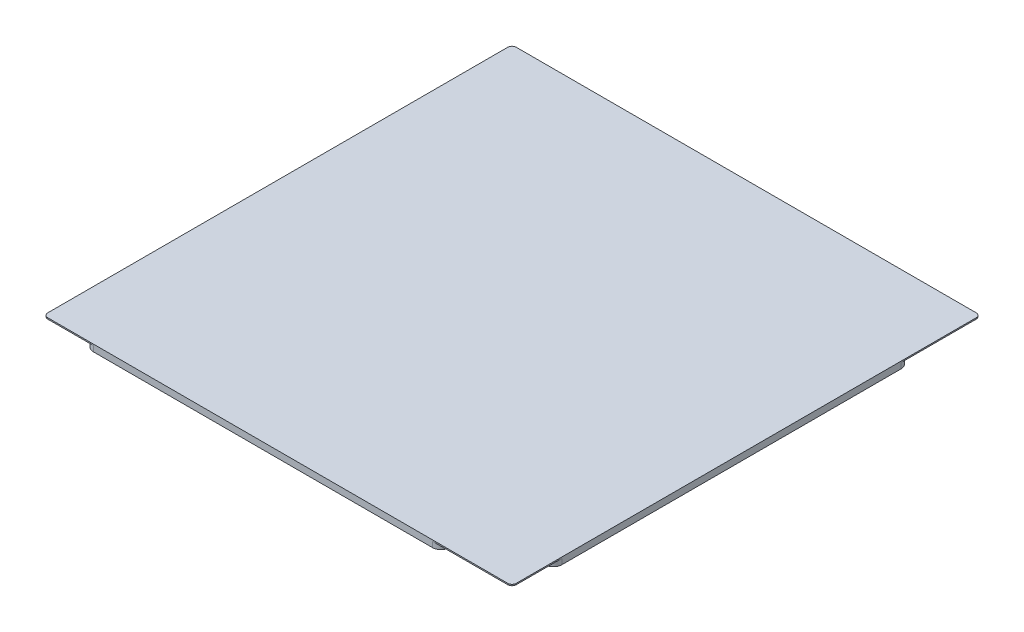
from build123d import *

# Parameters (mm, degrees)
SKETCH1_W           = 111
SKETCH1_H           = 111
BOSS_EXTRUDE1_DEPTH = 0.15
SKETCH2_W           = 13.5
SKETCH2_H           = 84.333333334
SKETCH2_W_2         = 84.333333334
SKETCH2_H_2         = 13.5
BOSS_EXTRUDE2_DEPTH = 1.3
FILLET1_R           = 2
FILLET2_R           = 1


with BuildPart() as part:
    # Sketch1 → Boss-Extrude1 (new, symmetric)
    with BuildSketch(Plane(origin=(0, 0, 0), x_dir=(1, 0, 0), z_dir=(0, 1, 0))):
        Rectangle(SKETCH1_W, SKETCH1_H)
    extrude(amount=BOSS_EXTRUDE1_DEPTH, both=True)

    # Sketch2 → Boss-Extrude2 (add)
    with BuildSketch(Plane.XZ.offset(0.15)):
        with Locations((-48.75, -3.5)):
            Rectangle(SKETCH2_W, SKETCH2_H)
        with Locations((3.5, -48.75)):
            Rectangle(SKETCH2_W_2, SKETCH2_H_2)
        with Locations((-3.5, 48.75)):
            Rectangle(SKETCH2_W_2, SKETCH2_H_2)
        with Locations((48.75, 3.5)):
            Rectangle(SKETCH2_W, SKETCH2_H)
    extrude(amount=BOSS_EXTRUDE2_DEPTH)

    # Fillet1
    fillet1_edges = [part.edges().sort_by_distance(p)[0] for p in [
        (45.666666667, -0.8, -55.5),
        (45.666666667, -0.8, -42),
        (-38.666666667, -0.8, -42),
        (-38.666666667, -0.8, -55.5),
        (-42, -0.8, -45.666666667),
        (-42, -0.8, 38.666666667),
        (-55.5, -0.8, 38.666666667),
        (-55.5, -0.8, -45.666666667),
        (-45.666666667, -0.8, 42),
        (38.666666667, -0.8, 42),
        (38.666666667, -0.8, 55.5),
        (-45.666666667, -0.8, 55.5),
        (42, -0.8, 45.666666667),
        (42, -0.8, -38.666666667),
        (55.5, -0.8, -38.666666667),
        (55.5, -0.8, 45.666666667),
    ]]
    fillet(fillet1_edges, radius=FILLET1_R)

    # Fillet2
    fillet2_edges = [part.edges().sort_by_distance(p)[0] for p in [
        (55.5, 0, 55.5),
        (-55.5, 0, 55.5),
        (-55.5, 0, -55.5),
        (55.5, 0, -55.5),
    ]]
    fillet(fillet2_edges, radius=FILLET2_R)


solid = part.part
